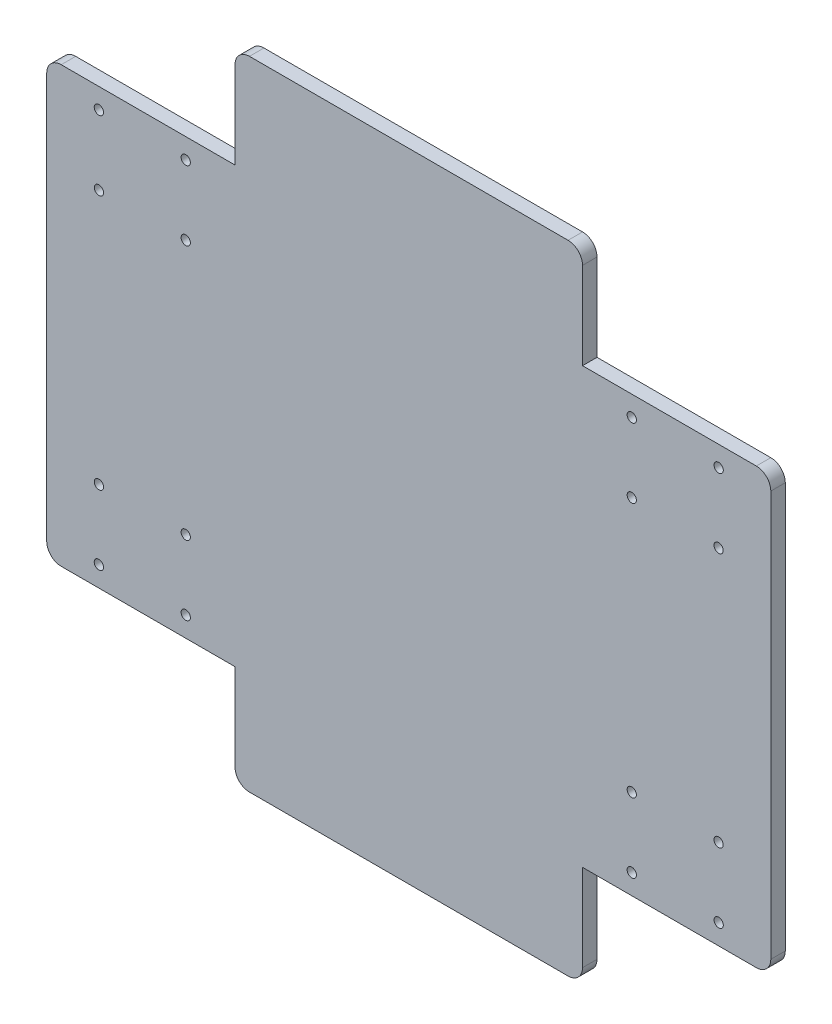
from build123d import *

# Parameters (mm, degrees)
SKETCH_1_R      = 1.6
EXTRUDE_1_DEPTH = 5
FILLET_1_R      = 5


with BuildPart() as part:
    # 草图1 → 凸台-拉伸1 (new body)
    with BuildSketch(Plane.XY):
        Polygon((-67.081805701, 36.641915025), (-2.081805701, 36.641915025), (-2.081805701, 71.641915025), (117.918194299, 71.641915025), (117.918194299, 36.641915025), (182.918194299, 36.641915025), (182.918194299, -113.358084975), (117.918194299, -113.358084975), (117.918194299, -148.358084975), (-2.081805701, -148.358084975), (-2.081805701, -113.358084975), (-67.081805701, -113.358084975), align=None)
        with Locations((-49.081283258, 29.641915025)):
            Circle(SKETCH_1_R, mode=Mode.SUBTRACT)
        with Locations((-19.081283258, 29.673445995)):
            Circle(SKETCH_1_R, mode=Mode.SUBTRACT)
        with Locations((-49.060066678, 5.641915025)):
            Circle(SKETCH_1_R, mode=Mode.SUBTRACT)
        with Locations((-19.081283258, 5.673445995)):
            Circle(SKETCH_1_R, mode=Mode.SUBTRACT)
        with Locations(Location((164.896455276, 5.641915025, 0), (0, 0, 180))):
            Circle(SKETCH_1_R, mode=Mode.SUBTRACT)
        with Locations(Location((134.917671856, 5.673445995, 0), (0, 0, 180))):
            Circle(SKETCH_1_R, mode=Mode.SUBTRACT)
        with Locations(Location((134.917671856, 29.673445995, 0), (0, 0, 180))):
            Circle(SKETCH_1_R, mode=Mode.SUBTRACT)
        with Locations(Location((164.917671856, 29.641915025, 0), (0, 0, 180))):
            Circle(SKETCH_1_R, mode=Mode.SUBTRACT)
        with Locations((134.917671856, -82.389615946)):
            Circle(SKETCH_1_R, mode=Mode.SUBTRACT)
        with Locations((164.896455276, -82.358084975)):
            Circle(SKETCH_1_R, mode=Mode.SUBTRACT)
        with Locations((164.917671856, -106.358084975)):
            Circle(SKETCH_1_R, mode=Mode.SUBTRACT)
        with Locations((134.917671856, -106.389615946)):
            Circle(SKETCH_1_R, mode=Mode.SUBTRACT)
        with Locations(Location((-49.060066678, -82.358084975, 0), (0, 0, 180))):
            Circle(SKETCH_1_R, mode=Mode.SUBTRACT)
        with Locations(Location((-19.081283258, -82.389615946, 0), (0, 0, 180))):
            Circle(SKETCH_1_R, mode=Mode.SUBTRACT)
        with Locations(Location((-19.081283258, -106.389615946, 0), (0, 0, 180))):
            Circle(SKETCH_1_R, mode=Mode.SUBTRACT)
        with Locations(Location((-49.081283258, -106.358084975, 0), (0, 0, 180))):
            Circle(SKETCH_1_R, mode=Mode.SUBTRACT)
    extrude(amount=EXTRUDE_1_DEPTH)

    # 圆角1
    fillet_1_edges = [part.edges().sort_by_distance(p)[0] for p in [
        (-67.081805701, 36.641915025, 2.5),
        (-2.081805701, 71.641915025, 2.5),
        (117.918194299, 71.641915025, 2.5),
        (182.918194299, 36.641915025, 2.5),
        (182.918194299, -113.358084975, 2.5),
        (117.918194299, -148.358084975, 2.5),
        (-2.081805701, -148.358084975, 2.5),
        (-67.081805701, -113.358084975, 2.5),
    ]]
    fillet(fillet_1_edges, radius=FILLET_1_R)


solid = part.part
